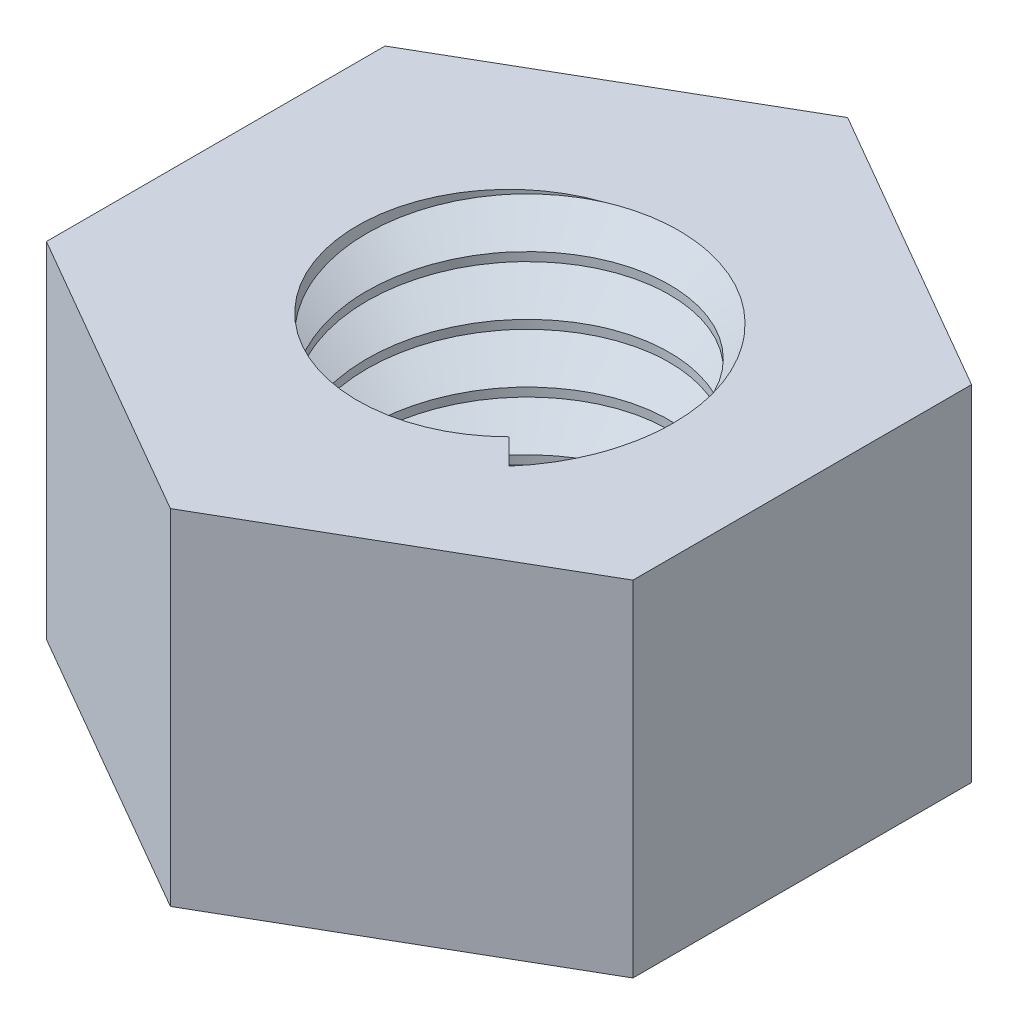
from build123d import *

# Parameters (mm, degrees)
HEXAGONO_DEPTH      = 4.7
TALADRO_PROFILE_R   = 2.067
ROSCA_M5X0_8_PITCH  = 0.8
ROSCA_M5X0_8_HEIGHT = 4.7
ROSCA_M5X0_8_RADIUS = 2.06696


with BuildPart() as part:
    # Sk_Hexagono → Hexagono (new body)
    with BuildSketch(Plane(origin=(0, 0, 0), x_dir=(1, 0, 0), z_dir=(0, 1, 0))):
        Polygon((4, -2.309401077), (0, -4.618802154), (-4, -2.309401077), (-4, 2.309401077), (0, 4.618802154), (4, 2.309401077), align=None)
    extrude(amount=HEXAGONO_DEPTH)

    # Taladro: sweep along a curve in space
    with BuildLine() as taladro_path:
        Line((0, -1, 0), (0, 5.7, 0))
    # Taladro profile (on start of the path) → Taladro (sweep, cut)
    with BuildSketch(Plane.ZX.offset(-1)):
        Circle(TALADRO_PROFILE_R)
    sweep(path=taladro_path.line, mode=Mode.SUBTRACT)

    # Rosca_M5x0,8: sweep along a helix
    with BuildLine() as rosca_m5x0_8_path:
        Helix(ROSCA_M5X0_8_PITCH, ROSCA_M5X0_8_HEIGHT, ROSCA_M5X0_8_RADIUS, center=(0, 0, 0), direction=(0, 1, 0), lefthand=True)
    # Sk_Perfil_rosca → Rosca_M5x0,8 (sweep, cut)
    with BuildSketch(Plane(origin=(0, 0, 0), x_dir=(0, 0, -1), z_dir=(1, 0, 0))):
        Polygon((-1.86696, -0.48), (-2.55768, 0), (-1.86696, 0.48), align=None)
    sweep(path=rosca_m5x0_8_path.line, is_frenet=True, mode=Mode.SUBTRACT)


solid = part.part
